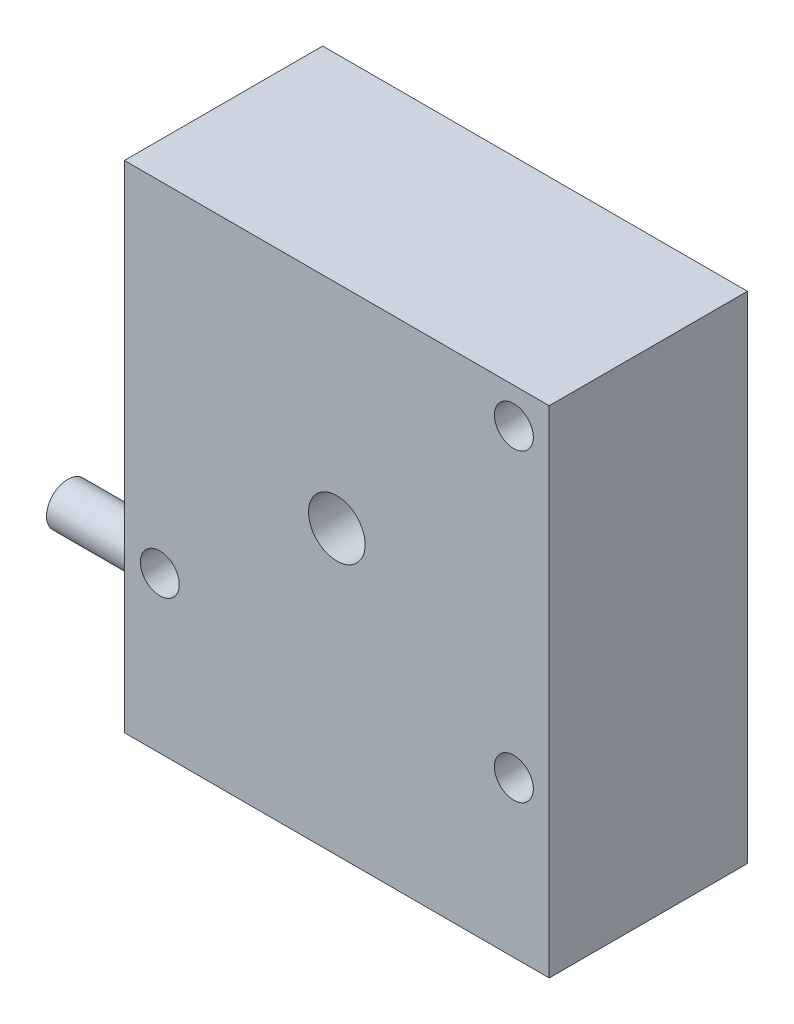
from build123d import *

# Parameters (mm, degrees)
ESQUISSE1_W      = 60
ESQUISSE1_H      = 70
EXTRUSION1_DEPTH = 28
ESQUISSE2_R      = 3
EXTRUSION2_DEPTH = 22
EXTRUSION3_REACH = 98.354
ESQUISSE3_R      = 4
D_GAGEMENT_M51_D = 5.5


with BuildPart() as part:
    # Esquisse1 → Extrusion1 (new body)
    with BuildSketch(Plane.XY):
        with Locations((30, 35)):
            Rectangle(ESQUISSE1_W, ESQUISSE1_H)
    extrude(amount=-EXTRUSION1_DEPTH)

    # Esquisse2 → Extrusion2 (add)
    with BuildSketch(Plane.ZY):
        with Locations((-14, 10)):
            Circle(ESQUISSE2_R)
    extrude(amount=EXTRUSION2_DEPTH)

    # Esquisse3 → Extrusion3 (cut, up to next)
    with BuildSketch(Plane.XY, mode=Mode.PRIVATE) as extrusion3_sk1:
        with Locations((30, 40)):
            Circle(ESQUISSE3_R)
    extrusion3_tool1 = extrude(extrusion3_sk1.sketch, amount=-EXTRUSION3_REACH, mode=Mode.PRIVATE) & part.part
    add(extrusion3_tool1.solids().sort_by_distance((30, 40, 0))[0], mode=Mode.SUBTRACT)

    # Dégagement M51 (through all)
    with Locations(Plane(origin=(55, 22, -28), x_dir=(-1, 0, 0), z_dir=(0, 0, -1))):
        with Locations((0, 0), (0, 43), (50, 0)):
            Hole(D_GAGEMENT_M51_D / 2)


solid = part.part
